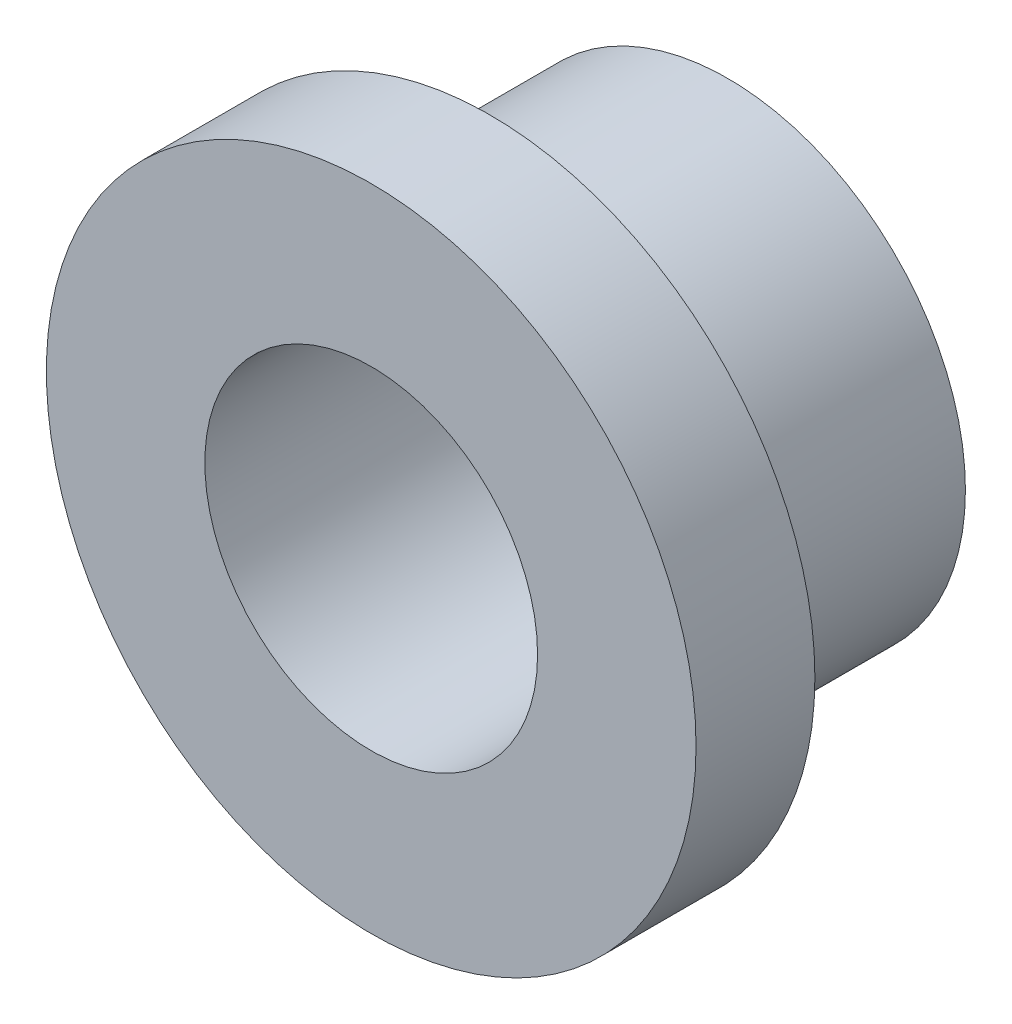
from build123d import *


with BuildPart() as part:
    # Sketch1 → Revolve1 (revolve)
    with BuildSketch(Plane(origin=(0, 0, 0), x_dir=(0, 0, -1), z_dir=(1, 0, 0)), mode=Mode.PRIVATE) as revolve1_sk:
        Polygon((0, 2.1), (0, 4.1), (1.5, 4.1), (1.5, 3), (4.5, 3), (4.5, 2.1), align=None)
    revolve(revolve1_sk.sketch.rotate(Axis((0, 0, 8.030450487), (0, 0, -1)), 90), axis=Axis((0, 0, 8.030450487), (0, 0, -1)))


solid = part.part
